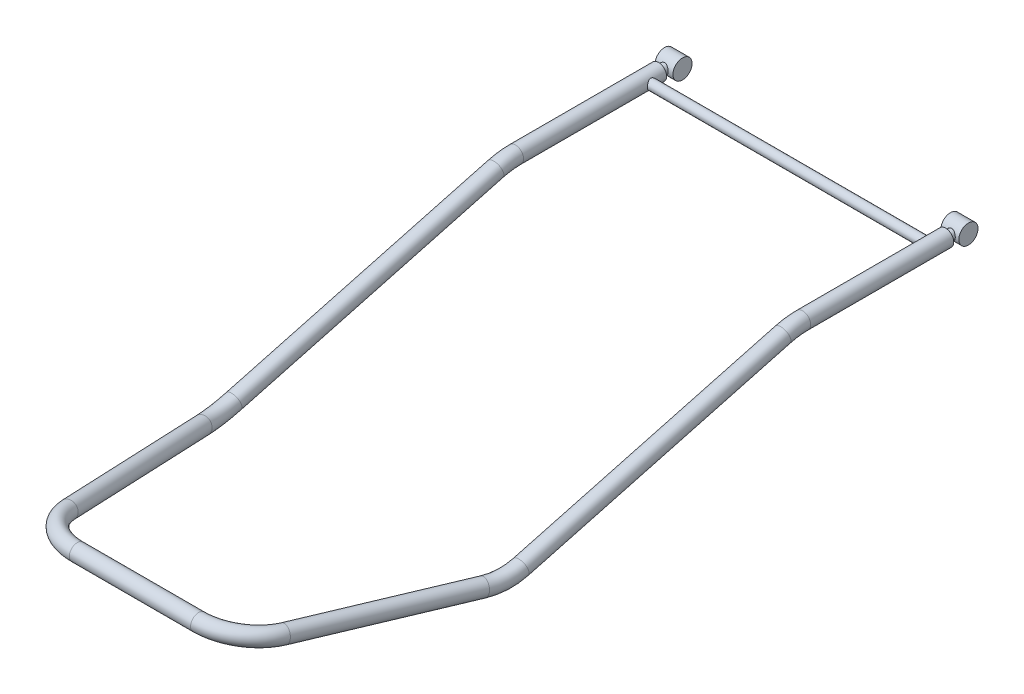
from build123d import *

# Parameters (mm, degrees)
MAIN_FRAME_PROFILE_R        = 10.668
CROSS_BAR_BOTTOM_PROFILE_R  = 6.35
SWIVEL_CONNECTION_PROFILE_R = 6.35
SWIVEL_OUTER_PROFILE_R      = 12.7


with BuildPart() as part:
    # Main Frame: sweep along a curve in space
    with BuildLine() as main_frame_path:
        Line((190.5, 0, 19.05), (190.5, 0, 208.874106245))
        ThreePointArc((190.5, 0, 208.874106245), (190.5, -0.869202084, 222.135567375), (190.5, -3.461936049, 235.170121228))
        Line((190.5, -3.461936049, 235.170121228), (190.5, -96.590179262, 582.729456518))
        ThreePointArc((186.008430573, -99.081814666, 628.564887795), (189.362259809, -100.245120407, 605.624792126), (190.5, -96.590179262, 582.729456518))
        Line((142.782679241, -64.080286866, 849.555836961), (186.008430573, -99.081814666, 628.564887795))
        ThreePointArc((80.435511173, -56.030942434, 900.377397559), (120.854542376, -58.303150976, 886.031237436), (142.782679241, -64.080286866, 849.555836961))
        Line((0, -56.030942434, 900.377397559), (80.435511173, -56.030942434, 900.377397559))
    # Main Frame profile (on start of the path) → Main Frame (sweep)
    with BuildSketch(Plane(origin=(190.5, 0, 19.05), x_dir=(0, 1, 0), z_dir=(0, 0, 1))):
        Circle(MAIN_FRAME_PROFILE_R)
    main_frame = sweep(path=main_frame_path.line)

    # Cross Bar Bottom: sweep along a curve in space
    with BuildLine() as cross_bar_bottom_path:
        Line((190.5, 0, 38.1), (0, 0, 38.1))
    # Cross Bar Bottom profile (on start of the path) → Cross Bar Bottom (sweep)
    with BuildSketch(Plane(origin=(190.5, 0, 38.1), x_dir=(0, -1, 0), z_dir=(-1, 0, 0))):
        Circle(CROSS_BAR_BOTTOM_PROFILE_R)
    cross_bar_bottom = sweep(path=cross_bar_bottom_path.line)

    # Swivel Connection: sweep along a curve in space
    with BuildLine() as swivel_connection_path:
        Line((190.5, 0, 0), (190.5, 0, 19.05))
    # Swivel Connection profile (on start of the path) → Swivel Connection (sweep)
    with BuildSketch(Plane(origin=(190.5, 0, 0), x_dir=(0, 1, 0), z_dir=(0, 0, 1))):
        Circle(SWIVEL_CONNECTION_PROFILE_R)
    swivel_connection = sweep(path=swivel_connection_path.line)

    # Swivel Outer: sweep along a curve in space
    with BuildLine() as swivel_outer_path:
        Line((201.6125, 0, 0), (177.8, 0, 0))
    # Swivel Outer profile (on start of the path) → Swivel Outer (sweep)
    with BuildSketch(Plane(origin=(201.6125, 0, 0), x_dir=(0, -1, 0), z_dir=(-1, 0, 0))):
        Circle(SWIVEL_OUTER_PROFILE_R)
    swivel_outer = sweep(path=swivel_outer_path.line)

    # Mirror1: Main Frame, Cross Bar Bottom, Swivel Connection, Swivel Outer across plane
    add(main_frame.mirror(Plane(origin=(0, 0, 0), x_dir=(0, 0, 1), z_dir=(1, 0, 0))))
    add(cross_bar_bottom.mirror(Plane(origin=(0, 0, 0), x_dir=(0, 0, 1), z_dir=(1, 0, 0))))
    add(swivel_connection.mirror(Plane(origin=(0, 0, 0), x_dir=(0, 0, 1), z_dir=(1, 0, 0))))
    add(swivel_outer.mirror(Plane(origin=(0, 0, 0), x_dir=(0, 0, 1), z_dir=(1, 0, 0))))


solid = part.part
